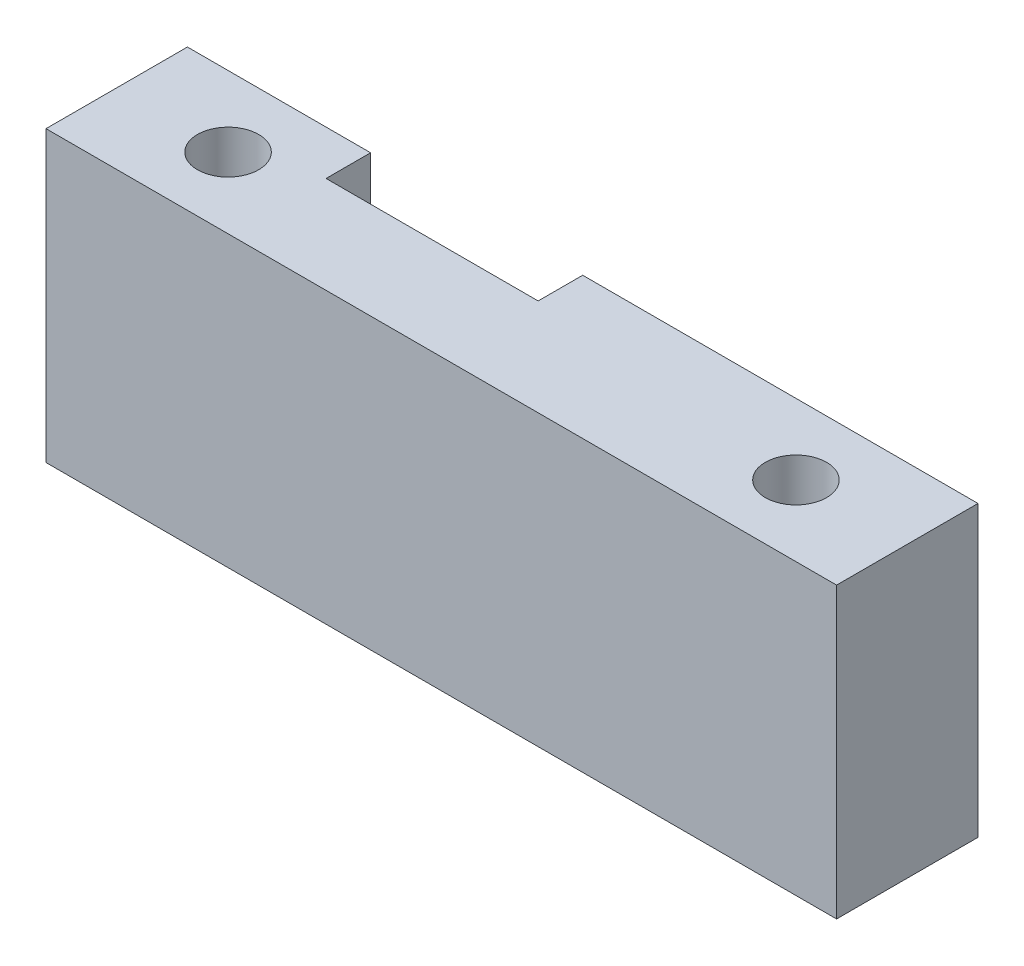
from build123d import *

# Parameters (mm, degrees)
SKETCH1_W           = 71
SKETCH1_H           = 12.7
SKETCH1_R           = 2.75
BOSS_EXTRUDE1_DEPTH = 25.97
SKETCH2_W           = 19.05
SKETCH2_H           = 25.97
CUT_EXTRUDE1_DEPTH  = 4


with BuildPart() as part:
    # Sketch1 → Boss-Extrude1 (new body)
    with BuildSketch(Plane(origin=(0, 0, 0), x_dir=(1, 0, 0), z_dir=(0, 1, 0))):
        with Locations((25.5, 0)):
            Rectangle(SKETCH1_W, SKETCH1_H)
        with Locations(Location((0, 0, 0), (0, 0, 270))):
            Circle(SKETCH1_R, mode=Mode.SUBTRACT)
        with Locations(Location((51, 0, 0), (0, 0, 90))):
            Circle(SKETCH1_R, mode=Mode.SUBTRACT)
    extrude(amount=BOSS_EXTRUDE1_DEPTH)

    # Sketch2 → Cut-Extrude1 (cut)
    with BuildSketch(Plane(origin=(0, 0, -6.35), x_dir=(-1, 0, 0), z_dir=(0, 0, -1))):
        with Locations((-15.975, 12.985)):
            Rectangle(SKETCH2_W, SKETCH2_H)
    extrude(amount=-CUT_EXTRUDE1_DEPTH, mode=Mode.SUBTRACT)


solid = part.part
